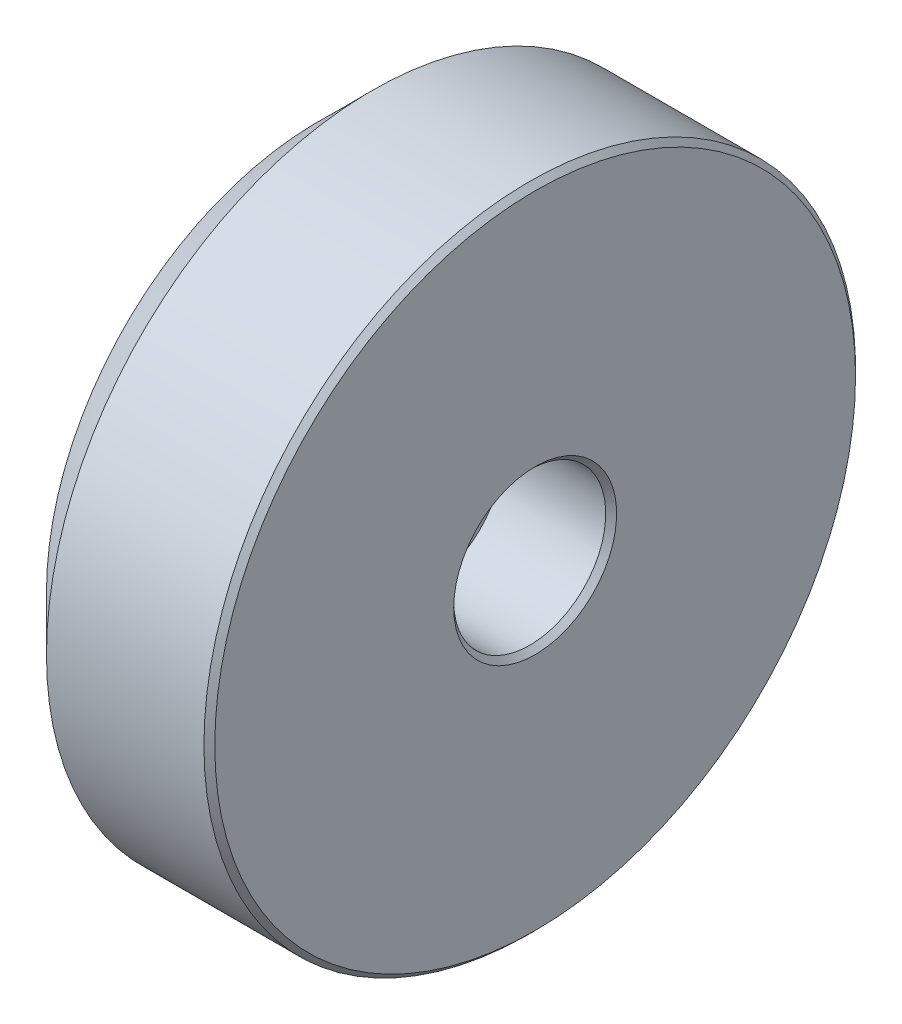
from build123d import *

# Parameters (mm, degrees)
CHAMFER_1_SIZE = 0.5
CHAMFER_2_SIZE = 0.5


with BuildPart() as part:
    # 스케치2 → 회전1 (revolve)
    with BuildSketch(Plane.XY, mode=Mode.PRIVATE) as revolve_1_sk:
        Polygon((0, 0), (0, 25), (5, 30), (20, 30), (20, 0), align=None)
    revolve(revolve_1_sk.sketch.rotate(Axis((0, 0, 0), (1, 0, 0)), 90), axis=Axis((0, 0, 0), (1, 0, 0)))

    # 스케치4 → 컷-회전1 (revolve, cut)
    with BuildSketch(Plane.XY, mode=Mode.PRIVATE) as cut_revolve_1_sk:
        Polygon((20, 7), (10, 7), (10, 4.5), (3, 4.5), (3, 10.25), (0, 10.25), (0, 0), (20, 0), align=None)
    revolve(cut_revolve_1_sk.sketch.rotate(Axis((0, 0, 0), (1, 0, 0)), 90), axis=Axis((0, 0, 0), (1, 0, 0)), mode=Mode.SUBTRACT)

    # 모따기1
    chamfer_1_edges = [part.edges().sort_by_distance(p)[0] for p in [
        (0, 0, -10.25),
        (20, 0, -7),
    ]]
    chamfer(chamfer_1_edges, length=CHAMFER_1_SIZE)

    # 모따기2
    chamfer_2_edges = [part.edges().sort_by_distance(p)[0] for p in [
        (20, 0, -30),
    ]]
    chamfer(chamfer_2_edges, length=CHAMFER_2_SIZE)


solid = part.part
